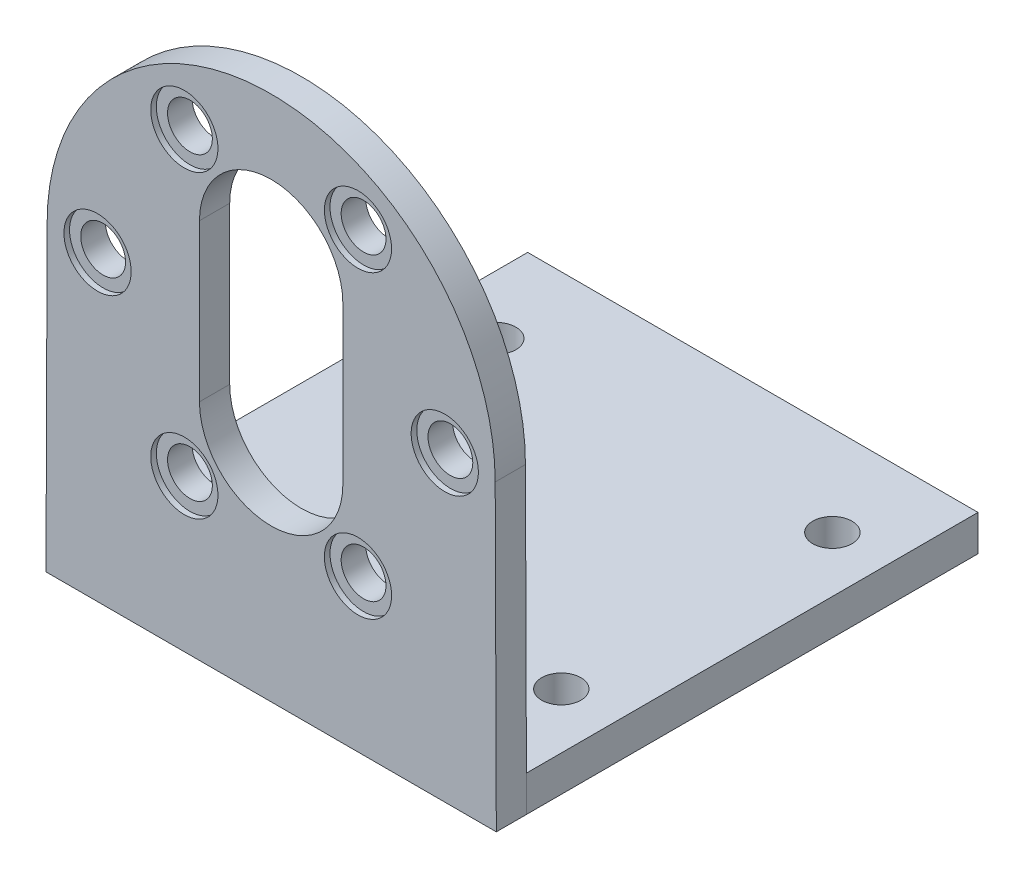
from build123d import *

# Parameters (mm, degrees)
SKETCH_1_W          = 40.2
SKETCH_1_H          = 43
EXTRUDE_1_DEPTH     = 3.2
SKETCH_3_W          = 40.2
SKETCH_3_H          = 2.7
EXTRUDE_3_DEPTH     = 43.8
SKETCH_4_OUTSIDE_W  = 57.266
SKETCH_4_OUTSIDE_H  = 64.066
CUT_EXTRUDE_2_DEPTH = 2.7
SKETCH_5_R          = 1.75
CUT_EXTRUDE_3_DEPTH = 53.770256774
CUT_EXTRUDE_4_DEPTH = 3.2
SKETCH_7_R          = 2
CUT_EXTRUDE_5_DEPTH = 3.2
SKETCH_8_R          = 3
CUT_EXTRUDE_6_DEPTH = 0.5


with BuildPart() as part:
    # 草图1 → 凸台-拉伸1 (new body)
    with BuildSketch(Plane(origin=(0, 0, 0), x_dir=(1, 0, 0), z_dir=(0, 1, 0))):
        Rectangle(SKETCH_1_W, SKETCH_1_H)
    extrude(amount=EXTRUDE_1_DEPTH)

    # 草图3 → 凸台-拉伸3 (add)
    with BuildSketch(Plane(origin=(0, 3.2, 0), x_dir=(1, 0, 0), z_dir=(0, 1, 0))):
        with Locations((0, -20.15)):
            Rectangle(SKETCH_3_W, SKETCH_3_H)
    extrude(amount=EXTRUDE_3_DEPTH)

    # 草图4 outside → 切除-拉伸2 (cut)
    with BuildSketch(Plane.XY.offset(21.5)):
        with Locations((0, 23.5)):
            Rectangle(SKETCH_4_OUTSIDE_W, SKETCH_4_OUTSIDE_H)
        with BuildLine():
            Line((-20, 27), (-20.1, 0))
            Line((-20.1, 0), (20.1, 0))
            Line((20.1, 0), (20, 27))
            ThreePointArc((20, 27), (0, 47), (-20, 27))
        make_face(mode=Mode.SUBTRACT)
    extrude(amount=-CUT_EXTRUDE_2_DEPTH, mode=Mode.SUBTRACT)

    # 草图5 → 切除-拉伸3 (cut, through all)
    with BuildSketch(Plane(origin=(0, 3.2, 0), x_dir=(1, 0, 0), z_dir=(0, 1, 0))):
        with Locations(Location((-14.85, 13.45, 0), (0, 0, 270))):
            Circle(SKETCH_5_R)
        with Locations(Location((15.15, -10.75, 0), (0, 0, 270))):
            Circle(SKETCH_5_R)
        with Locations(Location((-14.85, -10.75, 0), (0, 0, 270))):
            Circle(SKETCH_5_R)
        with Locations(Location((15.15, 13.45, 0), (0, 0, 270))):
            Circle(SKETCH_5_R)
    extrude(amount=-CUT_EXTRUDE_3_DEPTH, mode=Mode.SUBTRACT)

    # 草图6 → 切除-拉伸4 (cut)
    with BuildSketch(Plane.XY.offset(21.5)):
        with BuildLine():
            Line((-6.4, 34), (-6.4, 20))
            ThreePointArc((-6.4, 20), (0, 13.6), (6.4, 20))
            Line((6.4, 20), (6.4, 34))
            ThreePointArc((6.4, 34), (0, 40.4), (-6.4, 34))
        make_face()
    extrude(amount=-CUT_EXTRUDE_4_DEPTH, mode=Mode.SUBTRACT)

    # 草图7 → 切除-拉伸5 (cut)
    with BuildSketch(Plane.XY.offset(21.5)):
        with Locations((-7.75, 40.4)):
            Circle(SKETCH_7_R)
        with Locations((7.75, 40.4)):
            Circle(SKETCH_7_R)
        with Locations((-15.5, 27)):
            Circle(SKETCH_7_R)
        with Locations((15.5, 27)):
            Circle(SKETCH_7_R)
        with Locations((-7.75, 13.6)):
            Circle(SKETCH_7_R)
        with Locations((7.75, 13.6)):
            Circle(SKETCH_7_R)
    extrude(amount=-CUT_EXTRUDE_5_DEPTH, mode=Mode.SUBTRACT)

    # 草图8 → 切除-拉伸6 (cut)
    with BuildSketch(Plane.XY.offset(21.5)):
        with Locations((-7.75, 40.4)):
            Circle(SKETCH_8_R)
        with Locations((7.75, 40.4)):
            Circle(SKETCH_8_R)
        with Locations((-15.5, 27)):
            Circle(SKETCH_8_R)
        with Locations((15.5, 27)):
            Circle(SKETCH_8_R)
        with Locations((-7.75, 13.6)):
            Circle(SKETCH_8_R)
        with Locations((7.75, 13.6)):
            Circle(SKETCH_8_R)
    extrude(amount=-CUT_EXTRUDE_6_DEPTH, mode=Mode.SUBTRACT)


solid = part.part
